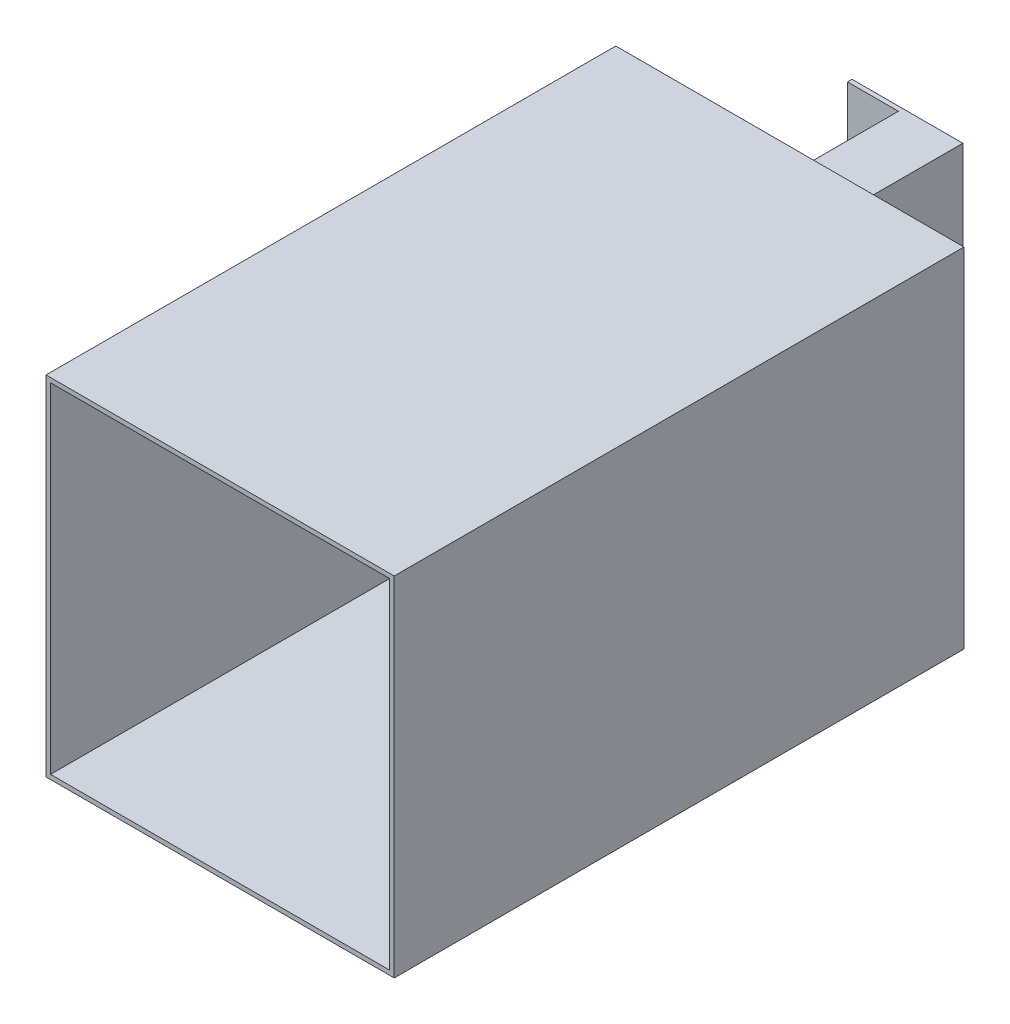
from build123d import *

# Parameters (mm, degrees)
SKETCH1_W           = 154
SKETCH1_H           = 154
SKETCH1_W_2         = 150
SKETCH1_H_2         = 150
BOSS_EXTRUDE1_DEPTH = 250
SKETCH2_W           = 154
SKETCH2_H           = 154
SKETCH2_R           = 20
SKETCH2_R_2         = 4
BOSS_EXTRUDE2_DEPTH = 2
BOSS_EXTRUDE3_DEPTH = 50
SKETCH4_W           = 49
SKETCH4_H           = 49
BOSS_EXTRUDE4_DEPTH = 2
SKETCH5_W           = 4
SKETCH5_H           = 45
CUT_EXTRUDE1_DEPTH  = 2
SKETCH6_R           = 4
CUT_EXTRUDE2_DEPTH  = 70
SKETCH9_R           = 74
SKETCH9_R_2         = 72
BOSS_EXTRUDE9_DEPTH = 50


with BuildPart() as part:
    # Sketch1 → Boss-Extrude1 (new body)
    with BuildSketch(Plane.XY):
        Rectangle(SKETCH1_W, SKETCH1_H)
        Rectangle(SKETCH1_W_2, SKETCH1_H_2, mode=Mode.SUBTRACT)
    extrude(amount=BOSS_EXTRUDE1_DEPTH)

    # Sketch2 → Boss-Extrude2 (add)
    with BuildSketch(Plane(origin=(0, 0, 0), x_dir=(-1, 0, 0), z_dir=(0, 0, -1))):
        Rectangle(SKETCH2_W, SKETCH2_H)
        with Locations((0, 40)):
            Circle(SKETCH2_R, mode=Mode.SUBTRACT)
        Circle(SKETCH2_R_2, mode=Mode.SUBTRACT)
    extrude(amount=BOSS_EXTRUDE2_DEPTH)

    # Sketch3 → Boss-Extrude3 (add)
    with BuildSketch(Plane(origin=(0, 0, -2), x_dir=(-1, 0, 0), z_dir=(0, 0, -1))):
        Polygon((2, 64.5), (2, 62.5), (0, 62.5), (-22.5, 62.5), (-22.5, 17.5), (0, 17.5), (2, 17.5), (2, 15.5), (-24.5, 15.5), (-24.5, 64.5), align=None)
    extrude(amount=BOSS_EXTRUDE3_DEPTH)

    # Sketch4 → Boss-Extrude4 (add)
    with BuildSketch(Plane(origin=(0, 0, -52), x_dir=(-1, 0, 0), z_dir=(0, 0, -1))):
        with Locations((0, 40)):
            Rectangle(SKETCH4_W, SKETCH4_H)
    extrude(amount=BOSS_EXTRUDE4_DEPTH)

    # Sketch5 → Cut-Extrude1 (cut)
    with BuildSketch(Plane(origin=(24.5, 0, 0), x_dir=(0, 0, -1), z_dir=(1, 0, 0))):
        with Locations((4, 40)):
            Rectangle(SKETCH5_W, SKETCH5_H)
    extrude(amount=-CUT_EXTRUDE1_DEPTH, mode=Mode.SUBTRACT)

    # Sketch6 → Cut-Extrude2 (cut)
    with BuildSketch(Plane(origin=(24.5, 0, 0), x_dir=(0, 0, -1), z_dir=(1, 0, 0))):
        with Locations((32, 40)):
            Circle(SKETCH6_R)
    extrude(amount=-CUT_EXTRUDE2_DEPTH, mode=Mode.SUBTRACT)

    # Sketch9 → Boss-Extrude9 (add)
    with BuildSketch(Plane.XY):
        with Locations(Location((0, 0, 0), (0, 0, 180))):
            Circle(SKETCH9_R)
        Circle(SKETCH9_R_2, mode=Mode.SUBTRACT)
    extrude(amount=BOSS_EXTRUDE9_DEPTH)


solid = part.part
